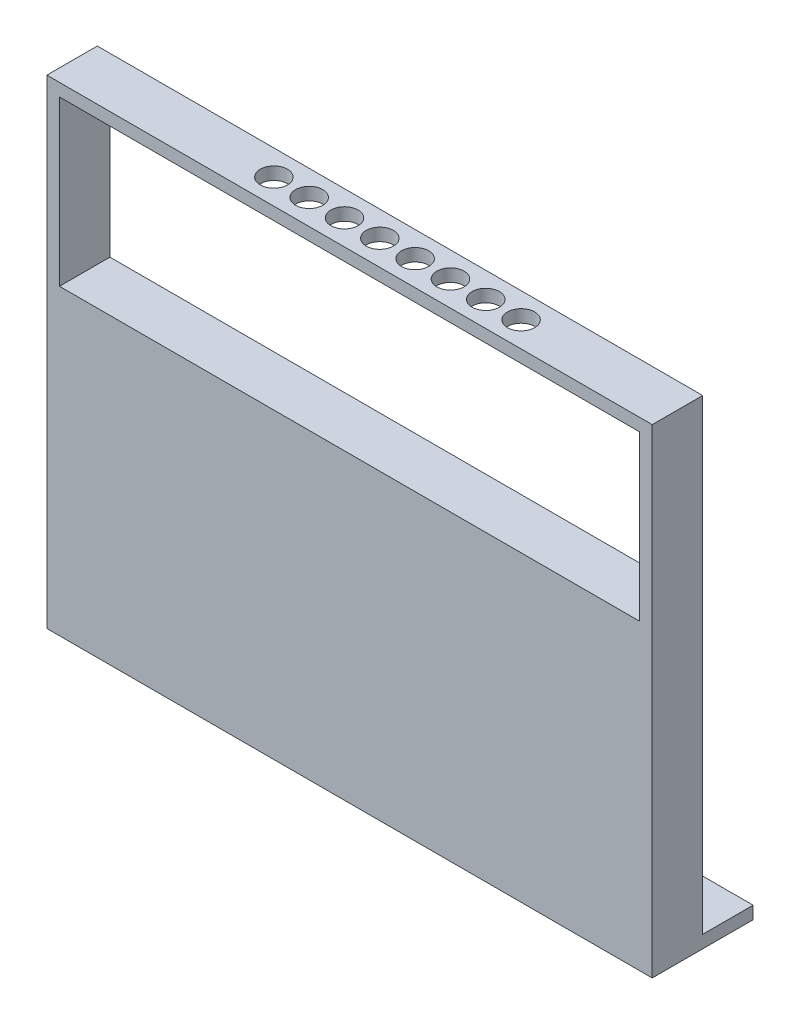
from build123d import *

# Parameters (mm, degrees)
SKETCH1_W           = 152.4
SKETCH1_H           = 12.7
BOSS_EXTRUDE1_DEPTH = 76.2
SKETCH2_R           = 3.175
BOSS_EXTRUDE4_DEPTH = 3.175
BOSS_EXTRUDE5_DEPTH = 12.7
CUT_EXTRUDE1_REACH  = 145.964
SKETCH4_R           = 3.429


with BuildPart() as part:
    # Sketch1 → Boss-Extrude1 (new body)
    with BuildSketch(Plane(origin=(0, 0, 0), x_dir=(1, 0, 0), z_dir=(0, 1, 0))):
        Rectangle(SKETCH1_W, SKETCH1_H)
    extrude(amount=BOSS_EXTRUDE1_DEPTH)

    # Sketch2 → Boss-Extrude4 (add)
    with BuildSketch(Plane(origin=(0, 0, 0), x_dir=(1, 0, 0), z_dir=(0, 1, 0))):
        Polygon((-76.2, 12.7), (-76.2, 6.35), (76.2, 6.35), (76.2, 19.05), (-76.2, 19.05), align=None)
        with Locations(Location((-69.85, 12.7, 0), (0, 0, 270))):
            Circle(SKETCH2_R, mode=Mode.SUBTRACT)
        with Locations(Location((-44.45, 12.7, 0), (0, 0, 270))):
            Circle(SKETCH2_R, mode=Mode.SUBTRACT)
        with Locations(Location((-19.05, 12.7, 0), (0, 0, 270))):
            Circle(SKETCH2_R, mode=Mode.SUBTRACT)
        with Locations(Location((6.35, 12.7, 0), (0, 0, 270))):
            Circle(SKETCH2_R, mode=Mode.SUBTRACT)
        with Locations(Location((31.75, 12.7, 0), (0, 0, 270))):
            Circle(SKETCH2_R, mode=Mode.SUBTRACT)
        with Locations(Location((57.15, 12.7, 0), (0, 0, 270))):
            Circle(SKETCH2_R, mode=Mode.SUBTRACT)
    extrude(amount=BOSS_EXTRUDE4_DEPTH)

    # Sketch3 → Boss-Extrude5 (add)
    with BuildSketch(Plane.XY.offset(6.35)):
        Polygon((-76.2, 76.2), (-76.2, 120.65), (76.2, 120.65), (76.2, 76.2), (73.025, 76.2), (73.025, 117.475), (-73.025, 117.475), (-73.025, 76.2), align=None)
    extrude(amount=-BOSS_EXTRUDE5_DEPTH)

    # Sketch4 → Cut-Extrude1 (cut, up to next)
    with BuildSketch(Plane(origin=(0, 120.65, 0), x_dir=(1, 0, 0), z_dir=(0, 1, 0)), mode=Mode.PRIVATE) as cut_extrude1_sk1:
        with Locations(Location((-25.4, 0, 0), (0, 0, 270))):
            Circle(SKETCH4_R)
    cut_extrude1_tool1 = extrude(cut_extrude1_sk1.sketch, amount=-CUT_EXTRUDE1_REACH, mode=Mode.PRIVATE) & part.part
    # Sketch4 → Cut-Extrude1 (cut, up to next)
    with BuildSketch(Plane(origin=(0, 120.65, 0), x_dir=(1, 0, 0), z_dir=(0, 1, 0)), mode=Mode.PRIVATE) as cut_extrude1_sk2:
        with Locations(Location((-16.51, 0, 0), (0, 0, 270))):
            Circle(SKETCH4_R)
    cut_extrude1_tool2 = extrude(cut_extrude1_sk2.sketch, amount=-CUT_EXTRUDE1_REACH, mode=Mode.PRIVATE) & part.part
    # Sketch4 → Cut-Extrude1 (cut, up to next)
    with BuildSketch(Plane(origin=(0, 120.65, 0), x_dir=(1, 0, 0), z_dir=(0, 1, 0)), mode=Mode.PRIVATE) as cut_extrude1_sk3:
        with Locations(Location((-7.62, 0, 0), (0, 0, 270))):
            Circle(SKETCH4_R)
    cut_extrude1_tool3 = extrude(cut_extrude1_sk3.sketch, amount=-CUT_EXTRUDE1_REACH, mode=Mode.PRIVATE) & part.part
    # Sketch4 → Cut-Extrude1 (cut, up to next)
    with BuildSketch(Plane(origin=(0, 120.65, 0), x_dir=(1, 0, 0), z_dir=(0, 1, 0)), mode=Mode.PRIVATE) as cut_extrude1_sk4:
        with Locations(Location((1.27, 0, 0), (0, 0, 270))):
            Circle(SKETCH4_R)
    cut_extrude1_tool4 = extrude(cut_extrude1_sk4.sketch, amount=-CUT_EXTRUDE1_REACH, mode=Mode.PRIVATE) & part.part
    # Sketch4 → Cut-Extrude1 (cut, up to next)
    with BuildSketch(Plane(origin=(0, 120.65, 0), x_dir=(1, 0, 0), z_dir=(0, 1, 0)), mode=Mode.PRIVATE) as cut_extrude1_sk5:
        with Locations(Location((10.16, 0, 0), (0, 0, 270))):
            Circle(SKETCH4_R)
    cut_extrude1_tool5 = extrude(cut_extrude1_sk5.sketch, amount=-CUT_EXTRUDE1_REACH, mode=Mode.PRIVATE) & part.part
    # Sketch4 → Cut-Extrude1 (cut, up to next)
    with BuildSketch(Plane(origin=(0, 120.65, 0), x_dir=(1, 0, 0), z_dir=(0, 1, 0)), mode=Mode.PRIVATE) as cut_extrude1_sk6:
        with Locations(Location((19.05, 0, 0), (0, 0, 270))):
            Circle(SKETCH4_R)
    cut_extrude1_tool6 = extrude(cut_extrude1_sk6.sketch, amount=-CUT_EXTRUDE1_REACH, mode=Mode.PRIVATE) & part.part
    # Sketch4 → Cut-Extrude1 (cut, up to next)
    with BuildSketch(Plane(origin=(0, 120.65, 0), x_dir=(1, 0, 0), z_dir=(0, 1, 0)), mode=Mode.PRIVATE) as cut_extrude1_sk7:
        with Locations(Location((27.94, 0, 0), (0, 0, 270))):
            Circle(SKETCH4_R)
    cut_extrude1_tool7 = extrude(cut_extrude1_sk7.sketch, amount=-CUT_EXTRUDE1_REACH, mode=Mode.PRIVATE) & part.part
    # Sketch4 → Cut-Extrude1 (cut, up to next)
    with BuildSketch(Plane(origin=(0, 120.65, 0), x_dir=(1, 0, 0), z_dir=(0, 1, 0)), mode=Mode.PRIVATE) as cut_extrude1_sk8:
        with Locations(Location((36.83, 0, 0), (0, 0, 270))):
            Circle(SKETCH4_R)
    cut_extrude1_tool8 = extrude(cut_extrude1_sk8.sketch, amount=-CUT_EXTRUDE1_REACH, mode=Mode.PRIVATE) & part.part
    add(cut_extrude1_tool1.solids().sort_by_distance((-25.4, 120.65, 0))[0], mode=Mode.SUBTRACT)
    add(cut_extrude1_tool2.solids().sort_by_distance((-16.51, 120.65, 0))[0], mode=Mode.SUBTRACT)
    add(cut_extrude1_tool3.solids().sort_by_distance((-7.62, 120.65, 0))[0], mode=Mode.SUBTRACT)
    add(cut_extrude1_tool4.solids().sort_by_distance((1.27, 120.65, 0))[0], mode=Mode.SUBTRACT)
    add(cut_extrude1_tool5.solids().sort_by_distance((10.16, 120.65, 0))[0], mode=Mode.SUBTRACT)
    add(cut_extrude1_tool6.solids().sort_by_distance((19.05, 120.65, 0))[0], mode=Mode.SUBTRACT)
    add(cut_extrude1_tool7.solids().sort_by_distance((27.94, 120.65, 0))[0], mode=Mode.SUBTRACT)
    add(cut_extrude1_tool8.solids().sort_by_distance((36.83, 120.65, 0))[0], mode=Mode.SUBTRACT)


solid = part.part
